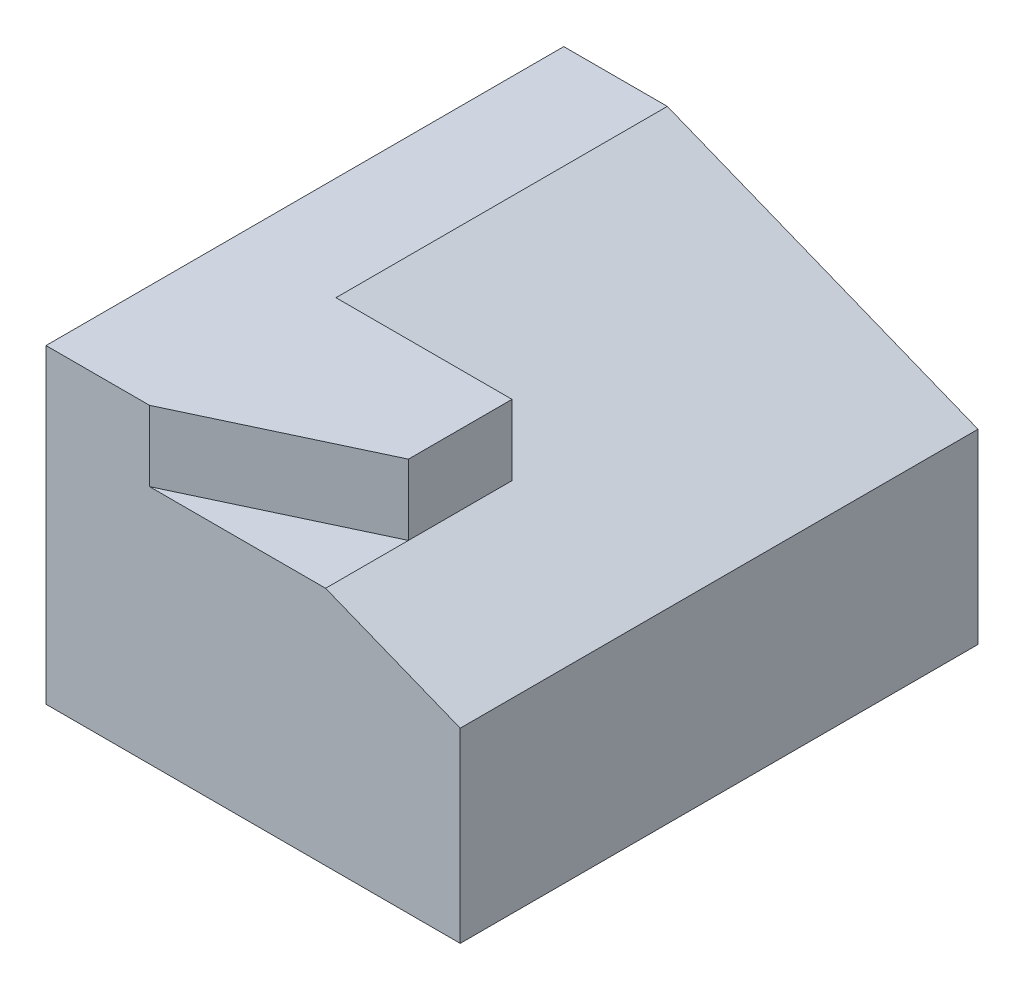
from build123d import *

# Parameters (mm, degrees)
SKETCH_1_W          = 50
SKETCH_1_H          = 30
EXTRUDE_1_DEPTH     = 40
CUT_EXTRUDE_1_DEPTH = 66.76473219
CUT_EXTRUDE_2_DEPTH = 56.901699437
SKETCH_4_W          = 17
SKETCH_4_H          = 6.8
CUT_EXTRUDE_3_DEPTH = 18
EXTRUDE_2_REACH     = 57.902
EXTRUDE_4_REACH     = 57.902


with BuildPart() as part:
    # Эскиз1 → Бобышка-Вытянуть1 (new body)
    with BuildSketch(Plane(origin=(0, 0, 0), x_dir=(0, 0, -1), z_dir=(1, 0, 0))):
        Rectangle(SKETCH_1_W, SKETCH_1_H)
    extrude(amount=EXTRUDE_1_DEPTH)

    # Эскиз2 → Вырез-Вытянуть1 (cut, through all)
    with BuildSketch(Plane.XY.offset(25)):
        Polygon((10, 15), (40, 3), (40, 15), align=None)
    extrude(amount=-CUT_EXTRUDE_1_DEPTH, mode=Mode.SUBTRACT)

    # Эскиз3 → Вырез-Вытянуть2 (cut, through all)
    with BuildSketch(Plane.XZ.offset(15)):
        Polygon((40, 13), (27, 25), (40, 25), align=None)
    extrude(amount=-CUT_EXTRUDE_2_DEPTH, mode=Mode.SUBTRACT)

    # Эскиз4 → Вырез-Вытянуть3 (cut)
    with BuildSketch(Plane.XY.offset(25)):
        with Locations((18.5, 11.6)):
            Rectangle(SKETCH_4_W, SKETCH_4_H)
    extrude(amount=-CUT_EXTRUDE_3_DEPTH, mode=Mode.SUBTRACT)

    # Бобышка-Вытянуть2: up to this face of the body (flat: up to its plane)
    extrude_2_end = Plane(part.part.faces().sort_by_distance((18.5, 8.2, 16))[0])
    # Эскиз5 → Бобышка-Вытянуть2 (add, up to the picked face)
    with BuildSketch(Plane(origin=(0, 15, 0), x_dir=(1, 0, 0), z_dir=(0, 1, 0)), mode=Mode.PRIVATE) as extrude_2_sk1:
        Polygon((10, -7), (27, -7), (27, -17), (10, -25), align=None)
    extrude_2_tool1 = split(extrude(extrude_2_sk1.sketch, amount=-EXTRUDE_2_REACH, mode=Mode.PRIVATE), bisect_by=extrude_2_end, keep=Keep.BOTH, mode=Mode.PRIVATE)
    add(extrude_2_tool1.solids().sort_by(Axis((17.690476, 15, 14.190476), (0, -1, 0)))[0])

    # Бобышка-Вытянуть4: up to this face of the body (flat: up to its plane)
    extrude_4_end = Plane(part.part.faces().sort_by_distance((26.036738351, 8.585304659, -5.85483871))[0])
    # Эскиз6 → Бобышка-Вытянуть4 (add, up to the picked face)
    with BuildSketch(Plane.XZ.offset(15), mode=Mode.PRIVATE) as extrude_4_sk1:
        Polygon((27, 25), (40, 13), (40, 25), align=None)
    extrude_4_tool1 = split(extrude(extrude_4_sk1.sketch, amount=-EXTRUDE_4_REACH, mode=Mode.PRIVATE), bisect_by=extrude_4_end, keep=Keep.BOTH, mode=Mode.PRIVATE)
    add(extrude_4_tool1.solids().sort_by(Axis((35.666667, -15, 21), (0, 1, 0)))[0])


solid = part.part
